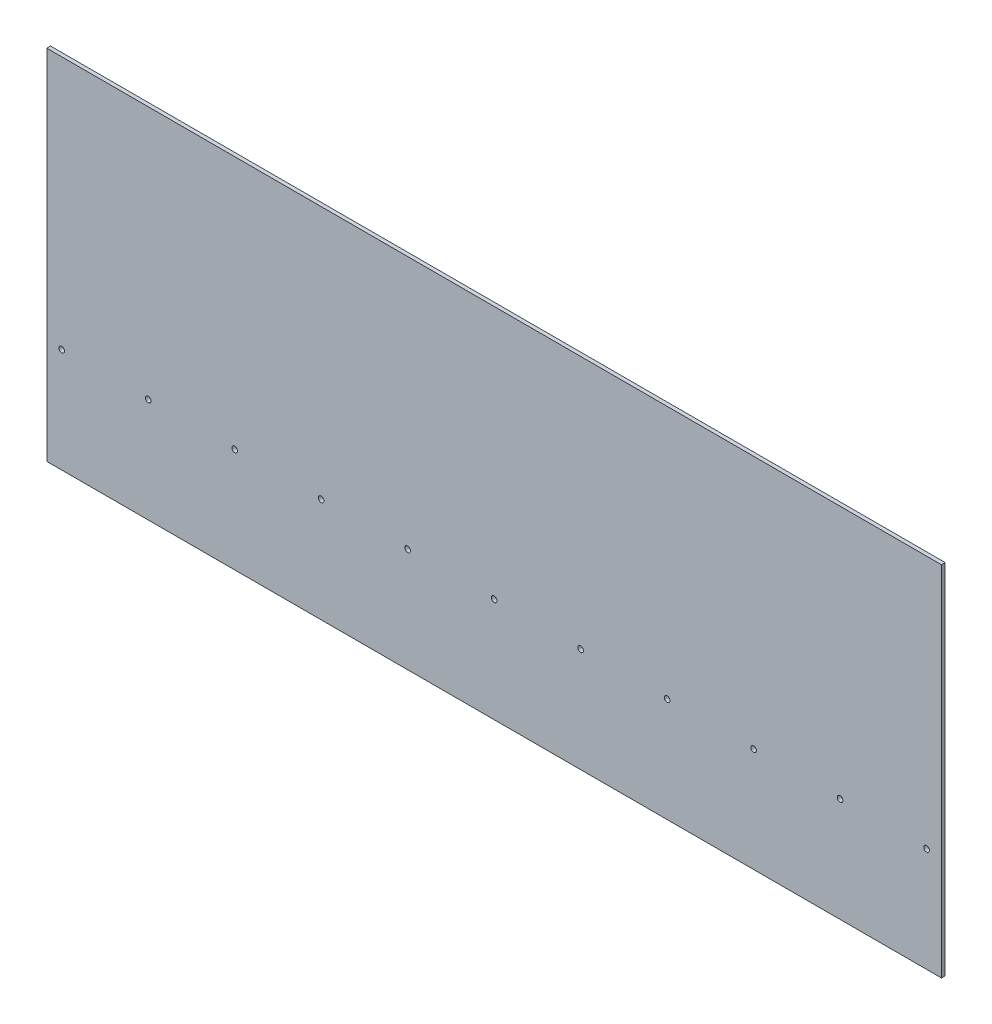
from build123d import *

# Parameters (mm, degrees)
SKETCH1_W           = 762
SKETCH1_H           = 304.8
BOSS_EXTRUDE1_DEPTH = 3.175
SKETCH2_R           = 2.413
CUT_EXTRUDE1_DEPTH  = 411.361841093


with BuildPart() as part:
    # Sketch1 → Boss-Extrude1 (new body)
    with BuildSketch(Plane.XY):
        Rectangle(SKETCH1_W, SKETCH1_H)
    extrude(amount=BOSS_EXTRUDE1_DEPTH)

    # Sketch2 → Cut-Extrude1 (cut, through all)
    with BuildSketch(Plane.XY.offset(3.175)):
        with Locations((-368.3, -63.5)):
            Circle(SKETCH2_R)
        with Locations((-294.64, -63.5)):
            Circle(SKETCH2_R)
        with Locations((-220.98, -63.5)):
            Circle(SKETCH2_R)
        with Locations((-147.32, -63.5)):
            Circle(SKETCH2_R)
        with Locations((-73.66, -63.5)):
            Circle(SKETCH2_R)
        with Locations((0, -63.5)):
            Circle(SKETCH2_R)
        with Locations((73.66, -63.5)):
            Circle(SKETCH2_R)
        with Locations((147.32, -63.5)):
            Circle(SKETCH2_R)
        with Locations((220.98, -63.5)):
            Circle(SKETCH2_R)
        with Locations((294.64, -63.5)):
            Circle(SKETCH2_R)
        with Locations((368.3, -63.5)):
            Circle(SKETCH2_R)
    extrude(amount=-CUT_EXTRUDE1_DEPTH, mode=Mode.SUBTRACT)


solid = part.part
